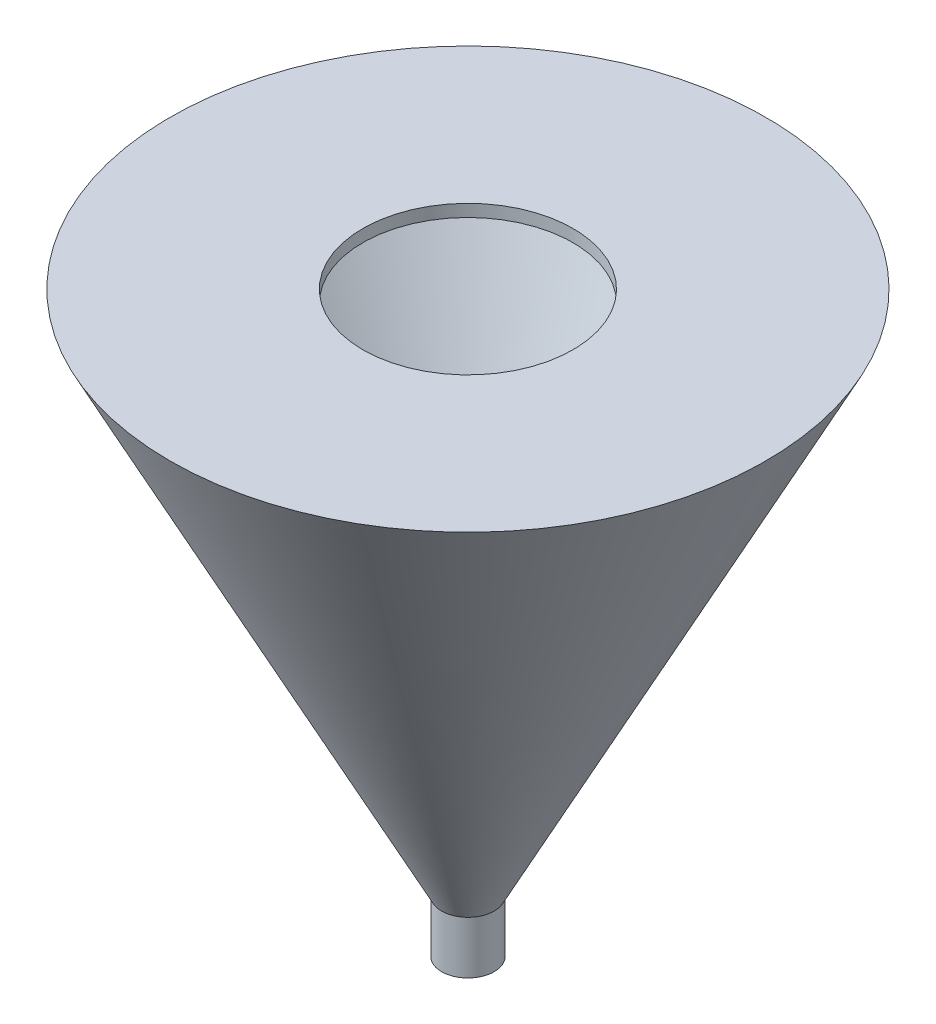
from build123d import *


with BuildPart() as part:
    # Croquis1 → Revolución1 (revolve)
    with BuildSketch(Plane.XY, mode=Mode.PRIVATE) as revoluci_n1_sk:
        Polygon((-7.5, 0), (-4.5, 0), (-4.5, 16.818487615), (-79.252114732, 161.5), (-30, 161.5), (-30, 165), (-85, 165), (-7.5, 15), align=None)
    revolve(revoluci_n1_sk.sketch.rotate(Axis((0, 51.291346199, 0), (0, -1, 0)), 270), axis=Axis((0, 51.291346199, 0), (0, -1, 0)))


solid = part.part
